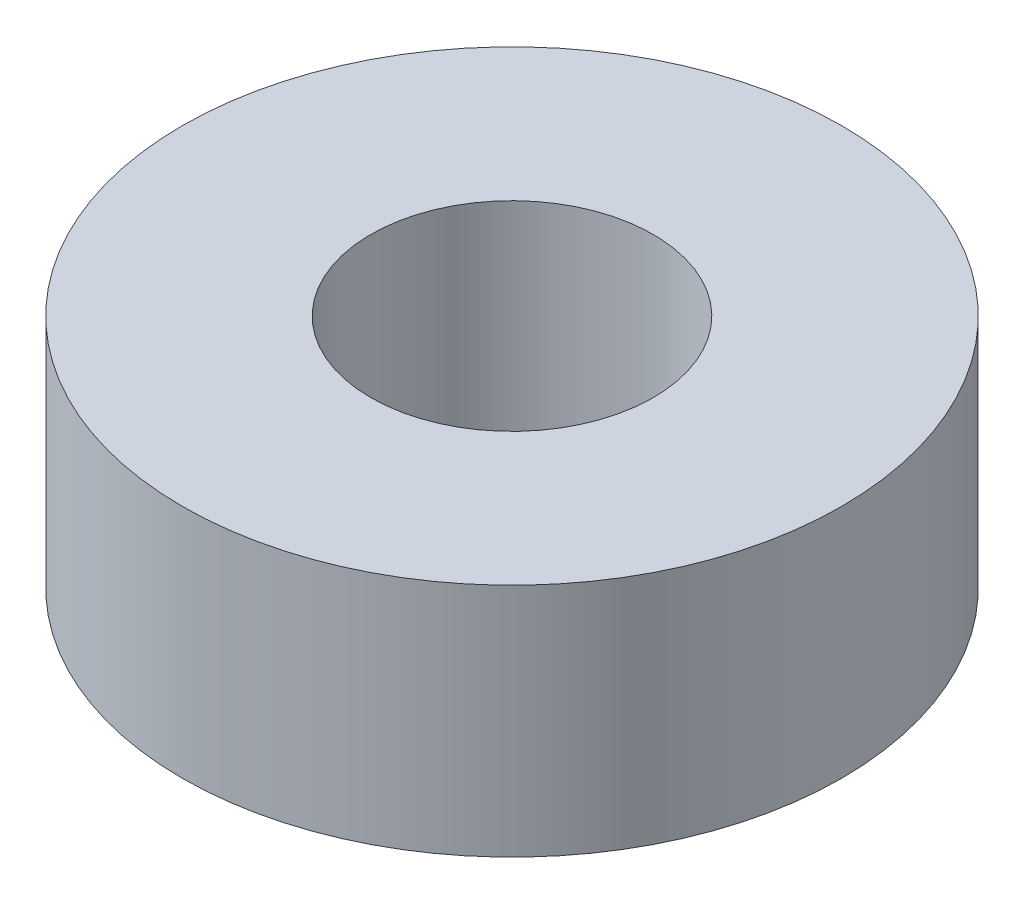
from build123d import *

# Parameters (mm, degrees)
SKETCH_1_R      = 7
SKETCH_1_R_2    = 3
EXTRUDE_1_DEPTH = 5


with BuildPart() as part:
    # 草图1 → 凸台-拉伸1 (new body)
    with BuildSketch(Plane(origin=(0, 0, 0), x_dir=(1, 0, 0), z_dir=(0, 1, 0))):
        with Locations(Location((0, 0, 0), (0, 0, 270))):
            Circle(SKETCH_1_R)
        with Locations(Location((0, 0, 0), (0, 0, 270))):
            Circle(SKETCH_1_R_2, mode=Mode.SUBTRACT)
    extrude(amount=EXTRUDE_1_DEPTH)


solid = part.part
